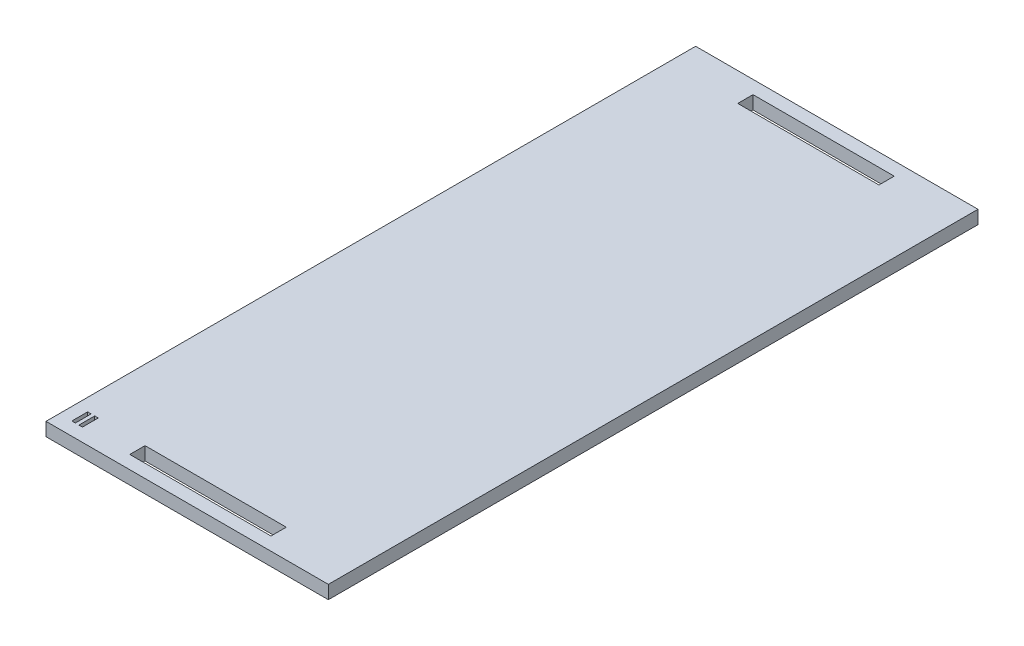
from build123d import *

# Parameters (mm, degrees)
SKETCH1_W           = 63.4746
SKETCH1_H           = 146.05
SKETCH1_W_2         = 31.75
SKETCH1_H_2         = 3.429
SKETCH1_W_3         = 0.79375
SKETCH1_H_3         = 3.556
BOSS_EXTRUDE1_DEPTH = 2.9972


with BuildPart() as part:
    # Sketch1 → Boss-Extrude1 (new body)
    with BuildSketch(Plane(origin=(0, 0, 0), x_dir=(1, 0, 0), z_dir=(0, 1, 0))):
        Rectangle(SKETCH1_W, SKETCH1_H)
        with Locations((0, 68.3387)):
            Rectangle(SKETCH1_W_2, SKETCH1_H_2, mode=Mode.SUBTRACT)
        with Locations((0, -68.3387)):
            Rectangle(SKETCH1_W_2, SKETCH1_H_2, mode=Mode.SUBTRACT)
        with Locations((-28.503386357, -68.2752)):
            Rectangle(SKETCH1_W_3, SKETCH1_H_3, mode=Mode.SUBTRACT)
        with Locations((-26.915886357, -68.2752)):
            Rectangle(SKETCH1_W_3, SKETCH1_H_3, mode=Mode.SUBTRACT)
    extrude(amount=BOSS_EXTRUDE1_DEPTH)


solid = part.part
